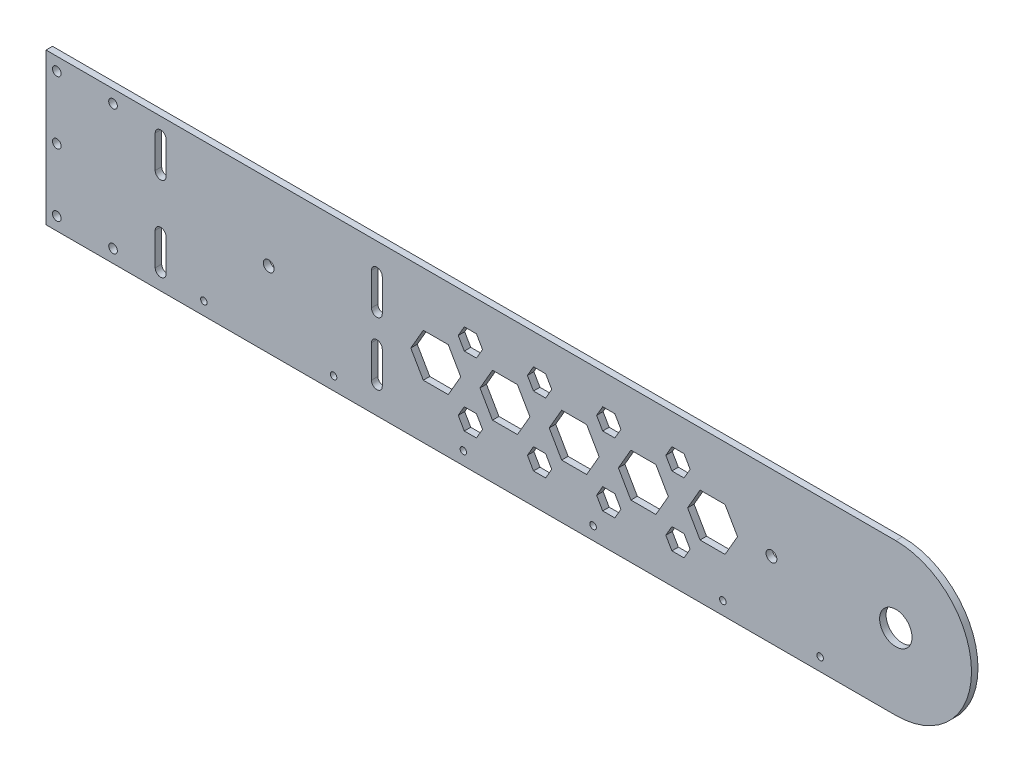
from build123d import *

# Parameters (mm, degrees)
SKETCH1_R               = 2
SKETCH1_R_2             = 7.5
SKETCH1_R_3             = 2.5
BOSS_EXTRUDE1_DEPTH     = 3
CUT_EXTRUDE1_DEPTH      = 430.43916915
CUT_EXTRUDE1_DEPTH_BACK = 430.43916915
CUT_EXTRUDE2_DEPTH      = 430.43916915
CUT_EXTRUDE2_DEPTH_BACK = 430.43916915
SKETCH5_R               = 2.5
SKETCH7_R               = 1.5
CUT_EXTRUDE4_DEPTH      = 3
CUT_EXTRUDE6_DEPTH      = 10


with BuildPart() as part:
    # Sketch1 → Boss-Extrude1 (new body)
    with BuildSketch(Plane.XY):
        with BuildLine():
            Line((0, 35), (0, -35))
            Line((0, -35), (393, -35))
            ThreePointArc((393, -35), (428, 0), (393, 35))
            Line((393, 35), (0, 35))
        make_face()
        with Locations((5, 29)):
            Circle(SKETCH1_R, mode=Mode.SUBTRACT)
        with Locations(Location((5, -29, 0), (0, 0, 180))):
            Circle(SKETCH1_R, mode=Mode.SUBTRACT)
        with Locations((393, 0)):
            Circle(SKETCH1_R_2, mode=Mode.SUBTRACT)
        with Locations((103, 0)):
            Circle(SKETCH1_R_3, mode=Mode.SUBTRACT)
        with Locations((31, 29)):
            Circle(SKETCH1_R, mode=Mode.SUBTRACT)
        with Locations((31, -29)):
            Circle(SKETCH1_R, mode=Mode.SUBTRACT)
        with Locations((5, 0)):
            Circle(SKETCH1_R, mode=Mode.SUBTRACT)
    extrude(amount=BOSS_EXTRUDE1_DEPTH)

    # Sketch4 → Cut-Extrude1 (cut, two sides: drawn at the far end of the back side and taken through both)
    with BuildSketch(Plane.XY.offset(3).offset(-CUT_EXTRUDE1_DEPTH_BACK)):
        with BuildLine():
            Line((55.5, 27), (55.5, 12))
            ThreePointArc((55.5, 12), (53, 9.5), (50.5, 12))
            Line((50.5, 12), (50.5, 27))
            ThreePointArc((50.5, 27), (53, 29.5), (55.5, 27))
        make_face()
        with BuildLine():
            Line((155.5, 22), (155.5, 7))
            ThreePointArc((155.5, 7), (153, 4.5), (150.5, 7))
            Line((150.5, 7), (150.5, 22))
            ThreePointArc((150.5, 22), (153, 24.5), (155.5, 22))
        make_face()
        with BuildLine():
            Line((155.5, -22), (155.5, -7))
            ThreePointArc((155.5, -7), (153, -4.5), (150.5, -7))
            Line((150.5, -7), (150.5, -22))
            ThreePointArc((150.5, -22), (153, -24.5), (155.5, -22))
        make_face()
        with BuildLine():
            Line((55.5, -27), (55.5, -12))
            ThreePointArc((55.5, -12), (53, -9.5), (50.5, -12))
            Line((50.5, -12), (50.5, -27))
            ThreePointArc((50.5, -27), (53, -29.5), (55.5, -27))
        make_face()
    extrude(amount=CUT_EXTRUDE1_DEPTH + CUT_EXTRUDE1_DEPTH_BACK, mode=Mode.SUBTRACT)

    # Sketch5 → Cut-Extrude2 (cut, two sides: drawn at the far end of the back side and taken through both)
    with BuildSketch(Plane.XY.offset(3).offset(-CUT_EXTRUDE2_DEPTH_BACK)):
        with Locations((335.5, 0)):
            Circle(SKETCH5_R)
    extrude(amount=CUT_EXTRUDE2_DEPTH + CUT_EXTRUDE2_DEPTH_BACK, mode=Mode.SUBTRACT)

    # Sketch7 → Cut-Extrude4 (cut)
    with BuildSketch(Plane.XY.offset(3)):
        with Locations((73, -29)):
            Circle(SKETCH7_R)
        with Locations((133, -29)):
            Circle(SKETCH7_R)
        with Locations((193, -29)):
            Circle(SKETCH7_R)
        with Locations((253, -29)):
            Circle(SKETCH7_R)
        with Locations((313, -29)):
            Circle(SKETCH7_R)
        with Locations((358, -29)):
            Circle(SKETCH7_R)
    extrude(amount=-CUT_EXTRUDE4_DEPTH, mode=Mode.SUBTRACT)

    # Sketch9 → Cut-Extrude6 (cut)
    with BuildSketch(Plane.XY.offset(3)):
        Polygon((223.795, 0), (218.021497308, 10), (206.474491924, 10), (200.700989232, 0), (206.474491924, -10), (218.021497308, -10), align=None)
        Polygon((191.795, 0), (186.021497308, 10), (174.474491924, 10), (168.700989232, 0), (174.474491924, -10), (186.021497308, -10), align=None)
        Polygon((255.795, 0), (250.021497308, 10), (238.474491924, 10), (232.700989232, 0), (238.474491924, -10), (250.021497308, -10), align=None)
        Polygon((287.795, 0), (282.021497308, 10), (270.474491924, 10), (264.700989232, 0), (270.474491924, -10), (282.021497308, -10), align=None)
        Polygon((233.865777575, 16), (231.056886095, 20.865142755), (225.439103137, 20.865142755), (222.630211658, 16), (225.439103137, 11.134857245), (231.056886095, 11.134857245), align=None)
        Polygon((201.865777575, 16), (199.056886095, 20.865142755), (193.439103137, 20.865142755), (190.630211658, 16), (193.439103137, 11.134857245), (199.056886095, 11.134857245), align=None)
        Polygon((265.865777575, 16), (263.056886095, 20.865142755), (257.439103137, 20.865142755), (254.630211658, 16), (257.439103137, 11.134857245), (263.056886095, 11.134857245), align=None)
        Polygon((319.795, 0), (314.021497308, 10), (302.474491924, 10), (296.700989232, 0), (302.474491924, -10), (314.021497308, -10), align=None)
        Polygon((297.865777575, 16), (295.056886095, 20.865142755), (289.439103137, 20.865142755), (286.630211658, 16), (289.439103137, 11.134857245), (295.056886095, 11.134857245), align=None)
        Polygon((295.056886095, -11.134857245), (297.865777575, -16), (295.056886095, -20.865142755), (289.439103137, -20.865142755), (286.630211658, -16), (289.439103137, -11.134857245), align=None)
        Polygon((263.056886095, -11.134857245), (265.865777575, -16), (263.056886095, -20.865142755), (257.439103137, -20.865142755), (254.630211658, -16), (257.439103137, -11.134857245), align=None)
        Polygon((231.056886095, -11.134857245), (233.865777575, -16), (231.056886095, -20.865142755), (225.439103137, -20.865142755), (222.630211658, -16), (225.439103137, -11.134857245), align=None)
        Polygon((199.056886095, -11.134857245), (201.865777575, -16), (199.056886095, -20.865142755), (193.439103137, -20.865142755), (190.630211658, -16), (193.439103137, -11.134857245), align=None)
    extrude(amount=-CUT_EXTRUDE6_DEPTH, mode=Mode.SUBTRACT)


solid = part.part
